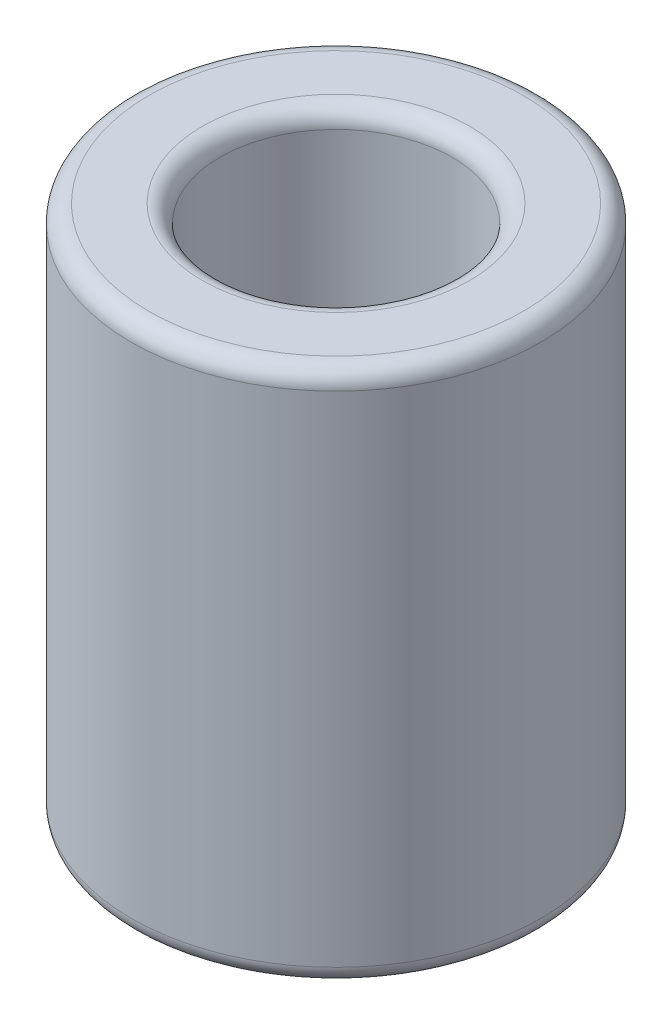
from build123d import *

# Parameters (mm, degrees)
SKETCH1_R           = 11.5
BOSS_EXTRUDE1_DEPTH = 30
SKETCH2_R           = 6.5
CUT_EXTRUDE1_DEPTH  = 35.124771062
FILLET2_R           = 1


with BuildPart() as part:
    # Sketch1 → Boss-Extrude1 (new body)
    with BuildSketch(Plane(origin=(0, 0, 0), x_dir=(1, 0, 0), z_dir=(0, 1, 0))):
        with Locations(Location((0, 0, 0), (0, 0, 270))):
            Circle(SKETCH1_R)
    extrude(amount=BOSS_EXTRUDE1_DEPTH)

    # Sketch2 → Cut-Extrude1 (cut, through all)
    with BuildSketch(Plane(origin=(0, 30, 0), x_dir=(1, 0, 0), z_dir=(0, 1, 0))):
        with Locations(Location((0, 0, 0), (0, 0, 270))):
            Circle(SKETCH2_R)
    extrude(amount=-CUT_EXTRUDE1_DEPTH, mode=Mode.SUBTRACT)

    # Fillet2
    fillet2_edges = [part.edges().sort_by_distance(p)[0] for p in [
        (0, 0, -11.5),
        (0, 30, -11.5),
        (0, 0, -6.5),
        (0, 30, -6.5),
    ]]
    fillet(fillet2_edges, radius=FILLET2_R)


solid = part.part
